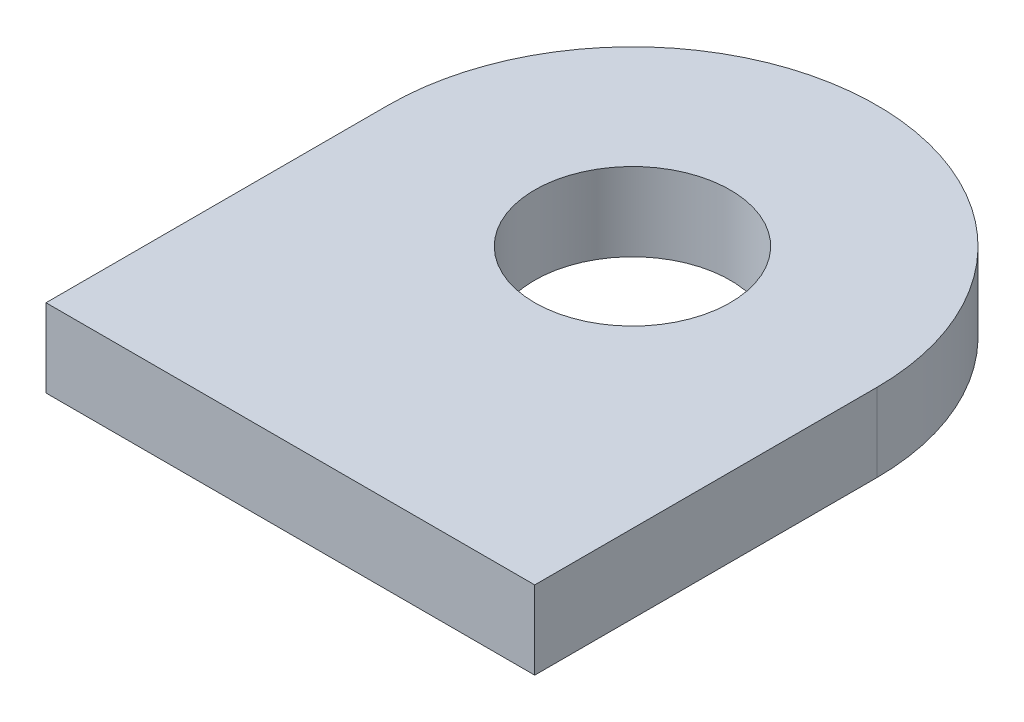
from build123d import *

# Parameters (mm, degrees)
BOSS_EXTRUDE1_DEPTH         = 2.54
F_1_4_0_25_DIAMETER_HOLE1_D = 6.35


with BuildPart() as part:
    # Sketch1 → Boss-Extrude1 (new body)
    with BuildSketch(Plane(origin=(0, 0, 0), x_dir=(1, 0, 0), z_dir=(0, 1, 0))):
        with BuildLine():
            Line((-7.9375, -11.1125), (7.9375, -11.1125))
            Line((7.9375, -11.1125), (7.9375, 0))
            ThreePointArc((7.9375, 0), (0, 7.9375), (-7.9375, 0))
            Line((-7.9375, 0), (-7.9375, -11.1125))
        make_face()
    extrude(amount=BOSS_EXTRUDE1_DEPTH)

    # 1/4 (0.25) Diameter Hole1 (through all)
    with Locations(Plane(origin=(0, 2.54, 0), x_dir=(1, 0, 0), z_dir=(0, 1, 0))):
        with Locations((0, 0)):
            Hole(F_1_4_0_25_DIAMETER_HOLE1_D / 2)


solid = part.part
